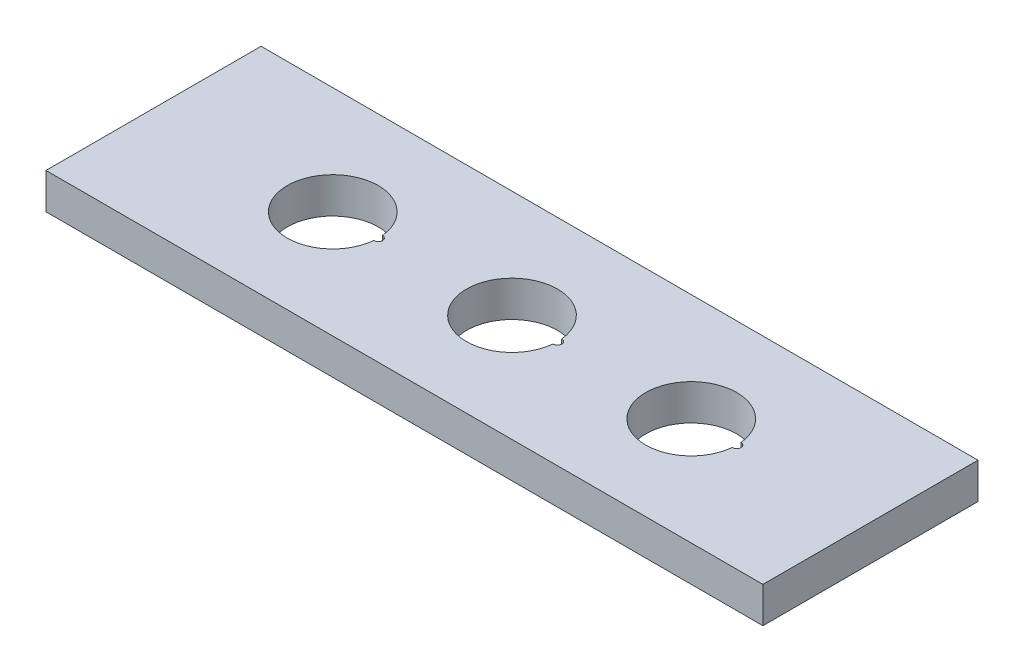
from build123d import *

# Parameters (mm, degrees)
SKETCH1_W           = 100
SKETCH1_H           = 30
BOSS_EXTRUDE1_DEPTH = 5


with BuildPart() as part:
    # Sketch1 → Boss-Extrude1 (new body)
    with BuildSketch(Plane(origin=(0, 0, 0), x_dir=(1, 0, 0), z_dir=(0, 1, 0))):
        Rectangle(SKETCH1_W, SKETCH1_H)
        with BuildLine():
            ThreePointArc((31.321653543, 0.599330025), (31.95, 0), (31.321653543, -0.599330025))
            ThreePointArc((31.321653543, -0.599330025), (18.65, 0), (31.321653543, 0.599330025))
        make_face(mode=Mode.SUBTRACT)
        with BuildLine():
            ThreePointArc((6.321653543, 0.599330025), (6.95, 0), (6.321653543, -0.599330025))
            ThreePointArc((6.321653543, -0.599330025), (-6.35, 0), (6.321653543, 0.599330025))
        make_face(mode=Mode.SUBTRACT)
        with BuildLine():
            ThreePointArc((-18.678346457, 0.599330025), (-18.05, 0), (-18.678346457, -0.599330025))
            ThreePointArc((-18.678346457, -0.599330025), (-31.35, 0), (-18.678346457, 0.599330025))
        make_face(mode=Mode.SUBTRACT)
    extrude(amount=BOSS_EXTRUDE1_DEPTH)


solid = part.part
